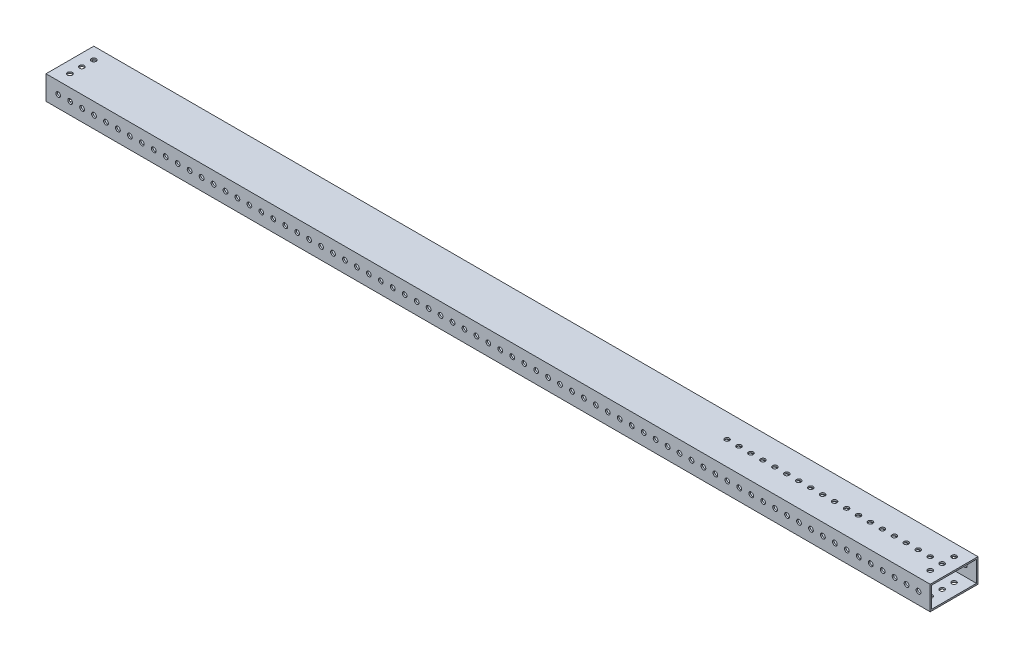
from build123d import *

# Parameters (mm, degrees)
SKETCH1_W           = 939.8
SKETCH1_H           = 50.8
SKETCH1_R           = 2.4892
BOSS_EXTRUDE1_DEPTH = 25.4
SKETCH2_W           = 47.577219443
SKETCH2_H           = 22.157059011
CUT_EXTRUDE1_DEPTH  = 941.486235944
SKETCH3_R           = 2.54
CUT_EXTRUDE2_DEPTH  = 474.319986901
SKETCH4_R           = 2.54
CUT_EXTRUDE3_DEPTH  = 472.270973008


with BuildPart() as part:
    # Sketch1 → Boss-Extrude1 (new body)
    with BuildSketch(Plane(origin=(0, 0, 0), x_dir=(1, 0, 0), z_dir=(0, 1, 0))):
        Rectangle(SKETCH1_W, SKETCH1_H)
        with Locations(Location((457.2, 0, 0), (0, 0, 270))):
            Circle(SKETCH1_R, mode=Mode.SUBTRACT)
        with Locations(Location((444.5, 0, 0), (0, 0, 270))):
            Circle(SKETCH1_R, mode=Mode.SUBTRACT)
        with Locations(Location((431.8, 0, 0), (0, 0, 270))):
            Circle(SKETCH1_R, mode=Mode.SUBTRACT)
        with Locations(Location((419.1, 0, 0), (0, 0, 270))):
            Circle(SKETCH1_R, mode=Mode.SUBTRACT)
        with Locations(Location((406.4, 0, 0), (0, 0, 270))):
            Circle(SKETCH1_R, mode=Mode.SUBTRACT)
        with Locations(Location((393.7, 0, 0), (0, 0, 270))):
            Circle(SKETCH1_R, mode=Mode.SUBTRACT)
        with Locations(Location((381, 0, 0), (0, 0, 270))):
            Circle(SKETCH1_R, mode=Mode.SUBTRACT)
        with Locations(Location((368.3, 0, 0), (0, 0, 270))):
            Circle(SKETCH1_R, mode=Mode.SUBTRACT)
        with Locations(Location((355.6, 0, 0), (0, 0, 270))):
            Circle(SKETCH1_R, mode=Mode.SUBTRACT)
        with Locations(Location((342.9, 0, 0), (0, 0, 270))):
            Circle(SKETCH1_R, mode=Mode.SUBTRACT)
        with Locations(Location((330.2, 0, 0), (0, 0, 270))):
            Circle(SKETCH1_R, mode=Mode.SUBTRACT)
        with Locations(Location((317.5, 0, 0), (0, 0, 270))):
            Circle(SKETCH1_R, mode=Mode.SUBTRACT)
        with Locations(Location((304.8, 0, 0), (0, 0, 270))):
            Circle(SKETCH1_R, mode=Mode.SUBTRACT)
        with Locations(Location((292.1, 0, 0), (0, 0, 270))):
            Circle(SKETCH1_R, mode=Mode.SUBTRACT)
        with Locations(Location((279.4, 0, 0), (0, 0, 270))):
            Circle(SKETCH1_R, mode=Mode.SUBTRACT)
        with Locations(Location((266.7, 0, 0), (0, 0, 270))):
            Circle(SKETCH1_R, mode=Mode.SUBTRACT)
        with Locations(Location((254, 0, 0), (0, 0, 270))):
            Circle(SKETCH1_R, mode=Mode.SUBTRACT)
        with Locations(Location((241.3, 0, 0), (0, 0, 270))):
            Circle(SKETCH1_R, mode=Mode.SUBTRACT)
        with Locations(Location((228.6, 0, 0), (0, 0, 270))):
            Circle(SKETCH1_R, mode=Mode.SUBTRACT)
    extrude(amount=BOSS_EXTRUDE1_DEPTH)

    # Sketch2 → Cut-Extrude1 (cut, through all)
    with BuildSketch(Plane.ZY.offset(469.9)):
        with Locations((0.005055824, 12.705024393)):
            Rectangle(SKETCH2_W, SKETCH2_H)
    extrude(amount=-CUT_EXTRUDE1_DEPTH, mode=Mode.SUBTRACT)

    # Sketch3 → Cut-Extrude2 (cut, through all)
    with BuildSketch(Plane.XY.offset(25.4)):
        with Locations((-456.946, 12.7)):
            Circle(SKETCH3_R)
        with Locations((-444.246, 12.7)):
            Circle(SKETCH3_R)
        with Locations((-431.546, 12.7)):
            Circle(SKETCH3_R)
        with Locations((-418.846, 12.7)):
            Circle(SKETCH3_R)
        with Locations((-406.146, 12.7)):
            Circle(SKETCH3_R)
        with Locations((-393.446, 12.7)):
            Circle(SKETCH3_R)
        with Locations((-380.746, 12.7)):
            Circle(SKETCH3_R)
        with Locations((-368.046, 12.7)):
            Circle(SKETCH3_R)
        with Locations((-355.346, 12.7)):
            Circle(SKETCH3_R)
        with Locations((-342.646, 12.7)):
            Circle(SKETCH3_R)
        with Locations((-329.946, 12.7)):
            Circle(SKETCH3_R)
        with Locations((-317.246, 12.7)):
            Circle(SKETCH3_R)
        with Locations((-304.546, 12.7)):
            Circle(SKETCH3_R)
        with Locations((-291.846, 12.7)):
            Circle(SKETCH3_R)
        with Locations((-279.146, 12.7)):
            Circle(SKETCH3_R)
        with Locations((-266.446, 12.7)):
            Circle(SKETCH3_R)
        with Locations((-253.746, 12.7)):
            Circle(SKETCH3_R)
        with Locations((-241.046, 12.7)):
            Circle(SKETCH3_R)
        with Locations((-228.346, 12.7)):
            Circle(SKETCH3_R)
        with Locations((-215.646, 12.7)):
            Circle(SKETCH3_R)
        with Locations((-202.946, 12.7)):
            Circle(SKETCH3_R)
        with Locations((-190.246, 12.7)):
            Circle(SKETCH3_R)
        with Locations((-177.546, 12.7)):
            Circle(SKETCH3_R)
        with Locations((-164.846, 12.7)):
            Circle(SKETCH3_R)
        with Locations((-152.146, 12.7)):
            Circle(SKETCH3_R)
        with Locations((-139.446, 12.7)):
            Circle(SKETCH3_R)
        with Locations((-126.746, 12.7)):
            Circle(SKETCH3_R)
        with Locations((-114.046, 12.7)):
            Circle(SKETCH3_R)
        with Locations((-101.346, 12.7)):
            Circle(SKETCH3_R)
        with Locations((-88.646, 12.7)):
            Circle(SKETCH3_R)
        with Locations((-75.946, 12.7)):
            Circle(SKETCH3_R)
        with Locations((-63.246, 12.7)):
            Circle(SKETCH3_R)
        with Locations((-50.546, 12.7)):
            Circle(SKETCH3_R)
        with Locations((-37.846, 12.7)):
            Circle(SKETCH3_R)
        with Locations((-25.146, 12.7)):
            Circle(SKETCH3_R)
        with Locations((-12.446, 12.7)):
            Circle(SKETCH3_R)
        with Locations((0.254, 12.7)):
            Circle(SKETCH3_R)
        with Locations((12.954, 12.7)):
            Circle(SKETCH3_R)
        with Locations((25.654, 12.7)):
            Circle(SKETCH3_R)
        with Locations((38.354, 12.7)):
            Circle(SKETCH3_R)
        with Locations((51.054, 12.7)):
            Circle(SKETCH3_R)
        with Locations((63.754, 12.7)):
            Circle(SKETCH3_R)
        with Locations((76.454, 12.7)):
            Circle(SKETCH3_R)
        with Locations((89.154, 12.7)):
            Circle(SKETCH3_R)
        with Locations((101.854, 12.7)):
            Circle(SKETCH3_R)
        with Locations((114.554, 12.7)):
            Circle(SKETCH3_R)
        with Locations((127.254, 12.7)):
            Circle(SKETCH3_R)
        with Locations((139.954, 12.7)):
            Circle(SKETCH3_R)
        with Locations((152.654, 12.7)):
            Circle(SKETCH3_R)
        with Locations((165.354, 12.7)):
            Circle(SKETCH3_R)
        with Locations((178.054, 12.7)):
            Circle(SKETCH3_R)
        with Locations((190.754, 12.7)):
            Circle(SKETCH3_R)
        with Locations((203.454, 12.7)):
            Circle(SKETCH3_R)
        with Locations((216.154, 12.7)):
            Circle(SKETCH3_R)
        with Locations((228.854, 12.7)):
            Circle(SKETCH3_R)
        with Locations((241.554, 12.7)):
            Circle(SKETCH3_R)
        with Locations((254.254, 12.7)):
            Circle(SKETCH3_R)
        with Locations((266.954, 12.7)):
            Circle(SKETCH3_R)
        with Locations((279.654, 12.7)):
            Circle(SKETCH3_R)
        with Locations((292.354, 12.7)):
            Circle(SKETCH3_R)
        with Locations((305.054, 12.7)):
            Circle(SKETCH3_R)
        with Locations((317.754, 12.7)):
            Circle(SKETCH3_R)
        with Locations((330.454, 12.7)):
            Circle(SKETCH3_R)
        with Locations((343.154, 12.7)):
            Circle(SKETCH3_R)
        with Locations((355.854, 12.7)):
            Circle(SKETCH3_R)
        with Locations((368.554, 12.7)):
            Circle(SKETCH3_R)
        with Locations((381.254, 12.7)):
            Circle(SKETCH3_R)
        with Locations((393.954, 12.7)):
            Circle(SKETCH3_R)
        with Locations((406.654, 12.7)):
            Circle(SKETCH3_R)
        with Locations((419.354, 12.7)):
            Circle(SKETCH3_R)
        with Locations((432.054, 12.7)):
            Circle(SKETCH3_R)
        with Locations((444.754, 12.7)):
            Circle(SKETCH3_R)
        with Locations((457.454, 12.7)):
            Circle(SKETCH3_R)
    extrude(amount=-CUT_EXTRUDE2_DEPTH, mode=Mode.SUBTRACT)

    # Sketch4 → Cut-Extrude3 (cut, through all)
    with BuildSketch(Plane(origin=(0, 25.4, 0), x_dir=(1, 0, 0), z_dir=(0, 1, 0))):
        with Locations(Location((-457.2, 12.7, 0), (0, 0, 270))):
            Circle(SKETCH4_R)
        with Locations(Location((-457.2, -12.7, 0), (0, 0, 270))):
            Circle(SKETCH4_R)
        with Locations(Location((-457.2, 0, 0), (0, 0, 270))):
            Circle(SKETCH4_R)
        with Locations(Location((457.2, 12.7, 0), (0, 0, 270))):
            Circle(SKETCH4_R)
        with Locations(Location((457.2, 0, 0), (0, 0, 270))):
            Circle(SKETCH4_R)
        with Locations(Location((457.2, -12.7, 0), (0, 0, 270))):
            Circle(SKETCH4_R)
    extrude(amount=-CUT_EXTRUDE3_DEPTH, mode=Mode.SUBTRACT)


solid = part.part
